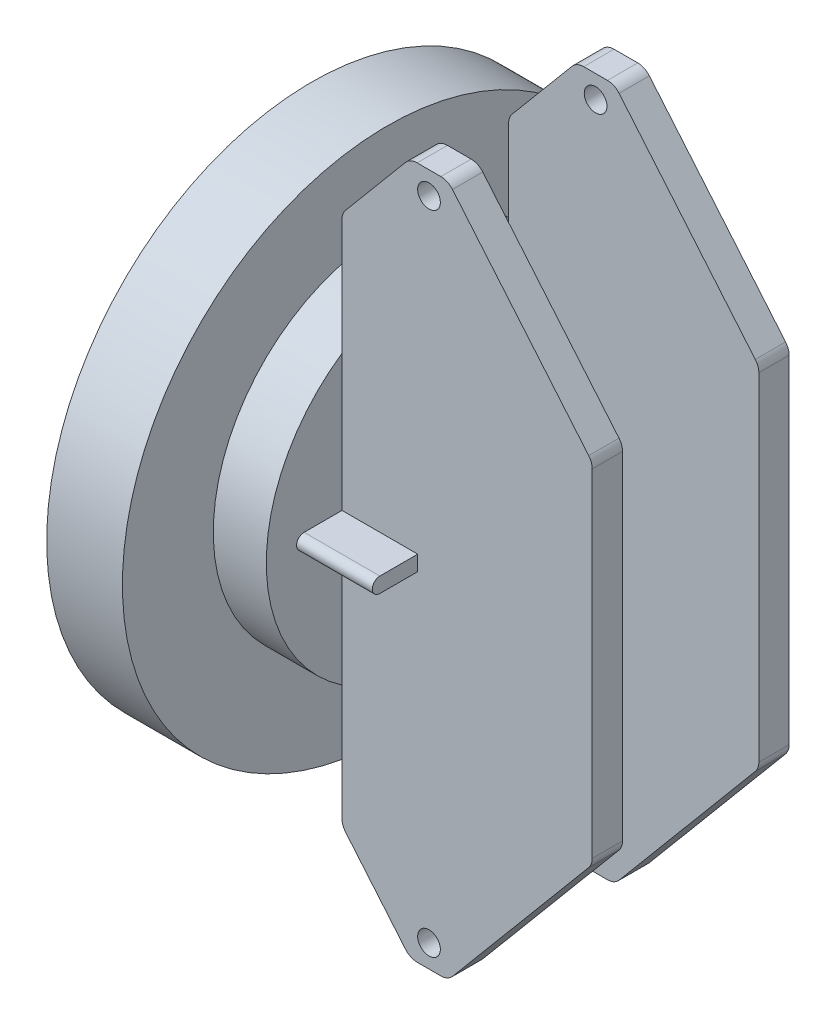
from build123d import *

# Parameters (mm, degrees)
SKETCH1_R                   = 35
BOSS_EXTRUDE1_DEPTH         = 10
SKETCH2_R                   = 23
BOSS_EXTRUDE2_DEPTH         = 7
BOSS_EXTRUDE3_DEPTH         = 4
SKETCH4_R                   = 1.5
CUT_EXTRUDE2_DEPTH          = 4
SKETCH5_W                   = 2
SKETCH5_H                   = 6
BOSS_EXTRUDE4_DEPTH         = 10
FILLET1_RADIUS              = 1
FILLET1_LENGTH              = 10
FILLET2_R                   = 2
FILLET1_OF_MIRROR2_2_RADIUS = 1
FILLET1_OF_MIRROR2_2_LENGTH = 10
FILLET2_OF_MIRROR2_R        = 2
SKETCH6_R                   = 15
CUT_EXTRUDE3_DEPTH          = 10


with BuildPart() as part:
    # Sketch1 → Boss-Extrude1 (new body)
    with BuildSketch(Plane.YZ):
        with Locations(Location((0, 0, 0), (0, 0, 270))):
            Circle(SKETCH1_R)
    extrude(amount=BOSS_EXTRUDE1_DEPTH)

    # Sketch2 → Boss-Extrude2 (add)
    with BuildSketch(Plane.YZ.offset(10)):
        with Locations(Location((0, 0, 0), (0, 0, 270))):
            Circle(SKETCH2_R)
    extrude(amount=BOSS_EXTRUDE2_DEPTH)

    # Sketch3 → Boss-Extrude3 (add)
    with BuildSketch(Plane(origin=(0, 0, 13), x_dir=(0, 1, 0), z_dir=(0, 0, 1))):
        Polygon((35, -17), (-35, -17), (-45.711191774, -25.987757067), (-45.711191774, -30.987757067), (-23, -50.044709708), (23, -50.044709708), (45.711191774, -30.987757067), (45.711191774, -25.987757067), align=None)
    boss_extrude3 = extrude(amount=-BOSS_EXTRUDE3_DEPTH)

    # Sketch4 → Cut-Extrude2 (cut)
    with BuildSketch(Plane.XY.offset(13)):
        with Locations((28.487757067, -42.711191774)):
            Circle(SKETCH4_R)
        with Locations(Location((28.487757067, 42.711191774, 0), (0, 0, 180))):
            Circle(SKETCH4_R)
    cut_extrude2 = extrude(amount=-CUT_EXTRUDE2_DEPTH, mode=Mode.SUBTRACT)

    # Sketch5 → Boss-Extrude4 (add)
    with BuildSketch(Plane.YZ.offset(17)):
        with Locations((0, 16)):
            Rectangle(SKETCH5_W, SKETCH5_H)
    boss_extrude4 = extrude(amount=BOSS_EXTRUDE4_DEPTH)

    # Fillet1: full round fillet: the end face becomes a half cylinder, R = half its width
    fillet1_face = Plane((22, 0, 19), x_dir=(-1, 0, 0), z_dir=(0, 0, 1))  # on the end face: x along it, z out of the body
    fillet1_slab = fillet1_face.offset(-FILLET1_RADIUS / 2) * Box(FILLET1_LENGTH, 2 * FILLET1_RADIUS, FILLET1_RADIUS, mode=Mode.PRIVATE)  # the body's end, R deep
    fillet1_round = Plane((22, 0, 18), x_dir=(0, 0, 1), z_dir=(-1, 0, 0)) * Cylinder(FILLET1_RADIUS, FILLET1_LENGTH, mode=Mode.PRIVATE)  # its axis R under the face
    add(fillet1_slab - fillet1_round, mode=Mode.SUBTRACT)

    # Fillet2
    fillet2_edges = [part.edges().sort_by_distance(p)[0] for p in [
        (50.044709708, 23, 11),
        (50.044709708, -23, 11),
        (30.987757067, -45.711191774, 11),
        (25.987757067, -45.711191774, 11),
        (17, -35, 11),
        (17, 35, 11),
        (25.987757067, 45.711191774, 11),
        (30.987757067, 45.711191774, 11),
    ]]
    fillet(fillet2_edges, radius=FILLET2_R)

    # Mirror2: Boss-Extrude3, Cut-Extrude2, Boss-Extrude4 across plane
    add(boss_extrude3.mirror(Plane.XY))
    add(cut_extrude2.mirror(Plane.XY), mode=Mode.SUBTRACT)
    add(boss_extrude4.mirror(Plane.XY))

    # Fillet1 of Mirror2 2: full round fillet: the end face becomes a half cylinder, R = half its width
    fillet1_of_mirror2_2_face = Plane((22, 0, -19), x_dir=(-1, 0, 0), z_dir=(0, 0, -1))  # on the end face: x along it, z out of the body
    fillet1_of_mirror2_2_slab = fillet1_of_mirror2_2_face.offset(-FILLET1_OF_MIRROR2_2_RADIUS / 2) * Box(FILLET1_OF_MIRROR2_2_LENGTH, 2 * FILLET1_OF_MIRROR2_2_RADIUS, FILLET1_OF_MIRROR2_2_RADIUS, mode=Mode.PRIVATE)  # the body's end, R deep
    fillet1_of_mirror2_2_round = Plane((22, 0, -18), x_dir=(0, 0, -1), z_dir=(-1, 0, 0)) * Cylinder(FILLET1_OF_MIRROR2_2_RADIUS, FILLET1_OF_MIRROR2_2_LENGTH, mode=Mode.PRIVATE)  # its axis R under the face
    add(fillet1_of_mirror2_2_slab - fillet1_of_mirror2_2_round, mode=Mode.SUBTRACT)

    # Fillet2 of Mirror2
    fillet2_of_mirror2_edges = [part.edges().sort_by_distance(p)[0] for p in [
        (50.044709708, 23, -11),
        (50.044709708, -23, -11),
        (30.987757067, -45.711191774, -11),
        (25.987757067, -45.711191774, -11),
        (17, -35, -11),
        (17, 35, -11),
        (25.987757067, 45.711191774, -11),
        (30.987757067, 45.711191774, -11),
    ]]
    fillet(fillet2_of_mirror2_edges, radius=FILLET2_OF_MIRROR2_R)

    # Sketch6 → Cut-Extrude3 (cut)
    with BuildSketch(Plane(origin=(0, 0, 0), x_dir=(0, -1, 0), z_dir=(-1, 0, 0))):
        with Locations(Location((0, 0, 0), (0, 0, 90))):
            Circle(SKETCH6_R)
    extrude(amount=-CUT_EXTRUDE3_DEPTH, mode=Mode.SUBTRACT)


solid = part.part
